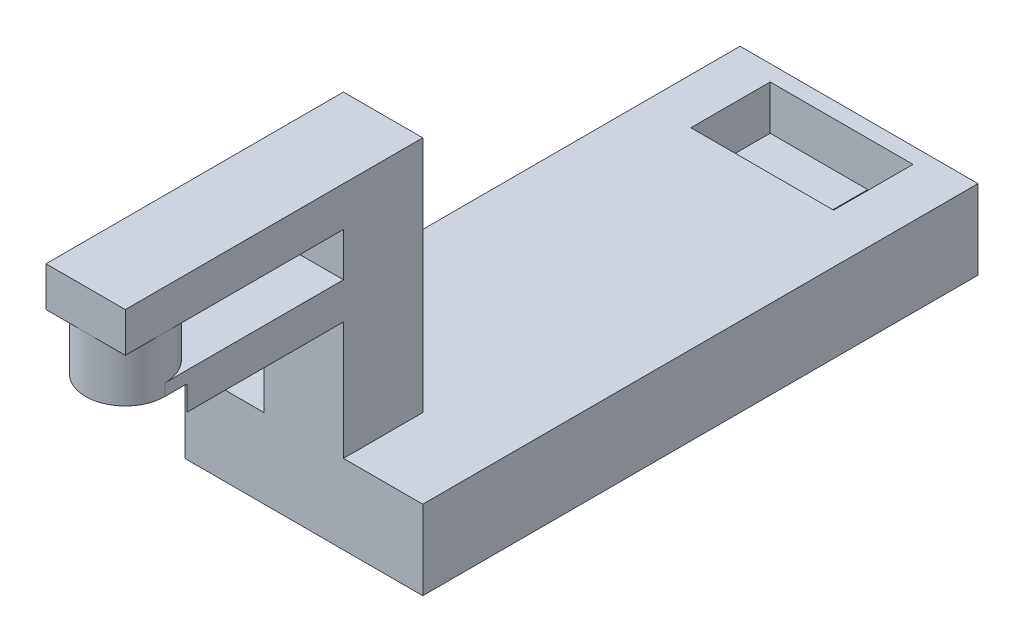
from build123d import *

# Parameters (mm, degrees)
SKETCH1_W           = 12.7
SKETCH1_H           = 50.8
BOSS_EXTRUDE1_DEPTH = 12.7
SKETCH2_W           = 12.7
SKETCH2_H           = 6.35
SKETCH2_H_2         = 5.842
BOSS_EXTRUDE2_DEPTH = 34.925
SKETCH4_R           = 6.35
BOSS_EXTRUDE3_DEPTH = 6.985
CUT_EXTRUDE1_START  = -3.937
CUT_EXTRUDE1_DEPTH  = 3.937
CUT_EXTRUDE2_DEPTH  = 12.827
BOSS_EXTRUDE4_START = -12.7
SKETCH6_W           = 38.1
SKETCH6_H           = 12.7
BOSS_EXTRUDE4_DEPTH = 88.9
SKETCH7_W           = 22.86
SKETCH7_H           = 12.7
CUT_EXTRUDE3_DEPTH  = 7.112
SKETCH9_W           = 2.794
SKETCH9_H           = 12.7
CUT_EXTRUDE4_DEPTH  = 91.628182394


with BuildPart() as part:
    # Sketch1 → Boss-Extrude1 (new body)
    with BuildSketch(Plane.XY):
        Rectangle(SKETCH1_W, SKETCH1_H)
    extrude(amount=BOSS_EXTRUDE1_DEPTH)

    # Sketch2 → Boss-Extrude2 (add)
    with BuildSketch(Plane.XY.offset(12.7)):
        with Locations((0, 22.225)):
            Rectangle(SKETCH2_W, SKETCH2_H)
        with Locations((0, 9.144)):
            Rectangle(SKETCH2_W, SKETCH2_H_2)
    extrude(amount=BOSS_EXTRUDE2_DEPTH)

    # Sketch4 → Boss-Extrude3 (add)
    with BuildSketch(Plane(origin=(0, 12.065, 0), x_dir=(1, 0, 0), z_dir=(0, 1, 0))):
        with Locations((0, -41.275)):
            Circle(SKETCH4_R)
    extrude(amount=BOSS_EXTRUDE3_DEPTH)

    # Sketch5 → Cut-Extrude1 (cut)
    with BuildSketch(Plane.XZ.offset(-6.223).offset(CUT_EXTRUDE1_START)):
        with BuildLine():
            Line((3.8, 16.775), (3.8, 30.925))
            ThreePointArc((3.8, 30.925), (4.31316702, 34.08727766), (5.8, 36.925))
            ThreePointArc((5.8, 36.925), (6.08989801, 37.34109072), (6.35, 37.776428863))
            Line((6.35, 37.776428863), (6.35, 41.275))
            ThreePointArc((6.35, 41.275), (4.490128061, 45.765128061), (0, 47.625))
            ThreePointArc((0, 47.625), (-4.490128061, 45.765128061), (-6.35, 41.275))
            Line((-6.35, 41.275), (-6.35, 37.776428863))
            ThreePointArc((-6.35, 37.776428863), (-6.08989801, 37.34109072), (-5.8, 36.925))
            ThreePointArc((-5.8, 36.925), (-4.313167019, 34.08727766), (-3.8, 30.925))
            Line((-3.8, 30.925), (-3.8, 16.775))
            ThreePointArc((-3.8, 16.775), (0, 12.975), (3.8, 16.775))
        make_face()
        with BuildLine():
            ThreePointArc((-6.35, 41.275), (-4.490128061, 45.765128061), (0, 47.625))
            Line((0, 47.625), (-3.498571137, 47.625))
            Line((-3.498571137, 47.625), (-6.35, 47.625))
            Line((-6.35, 47.625), (-6.35, 44.773571137))
            Line((-6.35, 44.773571137), (-6.35, 41.275))
        make_face()
        with BuildLine():
            ThreePointArc((0, 47.625), (4.490128061, 45.765128061), (6.35, 41.275))
            Line((6.35, 41.275), (6.35, 44.773571137))
            Line((6.35, 44.773571137), (6.35, 47.625))
            Line((6.35, 47.625), (3.498571137, 47.625))
            Line((3.498571137, 47.625), (0, 47.625))
        make_face()
    extrude(amount=CUT_EXTRUDE1_DEPTH, mode=Mode.SUBTRACT)

    # Sketch5<3> → Cut-Extrude2 (cut)
    with BuildSketch(Plane.XZ.offset(-6.223)):
        with BuildLine():
            ThreePointArc((-6.35, 41.275), (-4.490128061, 45.765128061), (0, 47.625))
            Line((0, 47.625), (-3.498571137, 47.625))
            Line((-3.498571137, 47.625), (-6.35, 47.625))
            Line((-6.35, 47.625), (-6.35, 44.773571137))
            Line((-6.35, 44.773571137), (-6.35, 41.275))
        make_face()
        with BuildLine():
            ThreePointArc((0, 47.625), (4.490128061, 45.765128061), (6.35, 41.275))
            Line((6.35, 41.275), (6.35, 44.773571137))
            Line((6.35, 44.773571137), (6.35, 47.625))
            Line((6.35, 47.625), (3.498571137, 47.625))
            Line((3.498571137, 47.625), (0, 47.625))
        make_face()
    extrude(amount=-CUT_EXTRUDE2_DEPTH, mode=Mode.SUBTRACT)

    # Sketch6 → Boss-Extrude4 (add)
    with BuildSketch(Plane(origin=(0, 0, 0), x_dir=(-1, 0, 0), z_dir=(0, 0, -1)).offset(BOSS_EXTRUDE4_START)):
        with Locations((0, -19.05)):
            Rectangle(SKETCH6_W, SKETCH6_H)
    extrude(amount=BOSS_EXTRUDE4_DEPTH)

    # Sketch7 → Cut-Extrude3 (cut)
    with BuildSketch(Plane(origin=(0, -12.7, 0), x_dir=(1, 0, 0), z_dir=(0, 1, 0))):
        with Locations((-0.254, 67.31)):
            Rectangle(SKETCH7_W, SKETCH7_H)
    extrude(amount=-CUT_EXTRUDE3_DEPTH, mode=Mode.SUBTRACT)

    # Sketch9 → Cut-Extrude4 (cut, through all)
    with BuildSketch(Plane(origin=(0, -19.812, 0), x_dir=(1, 0, 0), z_dir=(0, 1, 0))):
        with Locations((5.334, 67.31)):
            Rectangle(SKETCH9_W, SKETCH9_H)
    extrude(amount=-CUT_EXTRUDE4_DEPTH, mode=Mode.SUBTRACT)


solid = part.part
